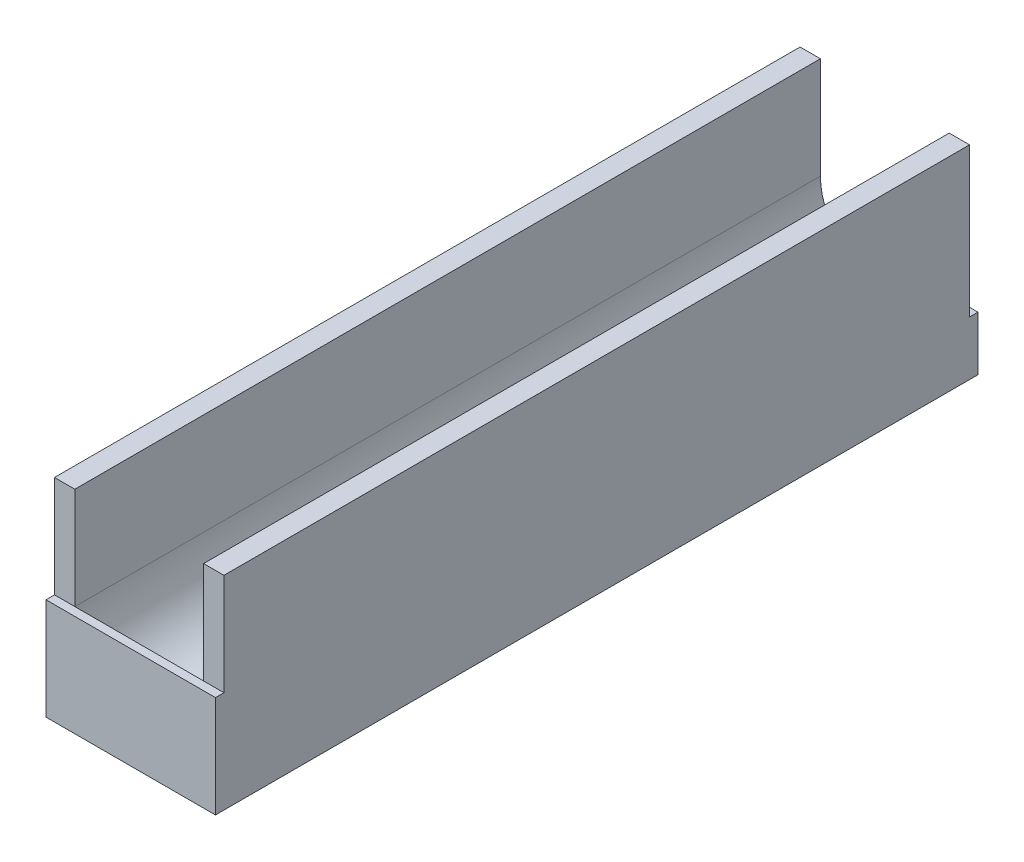
from build123d import *

# Parameters (mm, degrees)
SKETCH1_W                   = 31.75
SKETCH1_H                   = 38.1
BOSS_EXTRUDE1_DEPTH         = 139.7
CUT_EXTRUDE1_DEPTH          = 146.669885786
SKETCH3_R                   = 2
HEAT_SET_INSERT_HOLES_DEPTH = 7
SKETCH4_W                   = 31.75
SKETCH4_H                   = 19.05
BOSS_EXTRUDE2_DEPTH         = 1.5875
SKETCH5_W                   = 31.75
SKETCH5_H                   = 10.16
BOSS_EXTRUDE3_DEPTH         = 1.5875


with BuildPart() as part:
    # Sketch1 → Boss-Extrude1 (new body)
    with BuildSketch(Plane.XY):
        with Locations((0, 19.05)):
            Rectangle(SKETCH1_W, SKETCH1_H)
    extrude(amount=BOSS_EXTRUDE1_DEPTH)

    # Sketch2 → Cut-Extrude1 (cut, through all)
    with BuildSketch(Plane.XY.offset(139.7)):
        with BuildLine():
            Line((-12.065, 19.05), (-12.065, 38.1))
            Line((-12.065, 38.1), (12.065, 38.1))
            Line((12.065, 38.1), (12.065, 19.05))
            ThreePointArc((12.065, 19.05), (0, 6.985), (-12.065, 19.05))
        make_face()
    extrude(amount=-CUT_EXTRUDE1_DEPTH, mode=Mode.SUBTRACT)

    # Sketch3 → heat set insert holes (cut)
    with BuildSketch(Plane.XZ):
        with Locations(Location((-12.7, 130.81, 0), (0, 0, 270))):
            Circle(SKETCH3_R)
        with Locations(Location((12.7, 8.89, 0), (0, 0, 270))):
            Circle(SKETCH3_R)
    extrude(amount=-HEAT_SET_INSERT_HOLES_DEPTH, mode=Mode.SUBTRACT)

    # Sketch4 → Boss-Extrude2 (add)
    with BuildSketch(Plane.XY.offset(139.7)):
        with Locations((0, 9.525)):
            Rectangle(SKETCH4_W, SKETCH4_H)
    extrude(amount=BOSS_EXTRUDE2_DEPTH)

    # Sketch5 → Boss-Extrude3 (add)
    with BuildSketch(Plane(origin=(0, 0, 0), x_dir=(-1, 0, 0), z_dir=(0, 0, -1))):
        with Locations((0, 5.08)):
            Rectangle(SKETCH5_W, SKETCH5_H)
    extrude(amount=BOSS_EXTRUDE3_DEPTH)


solid = part.part
